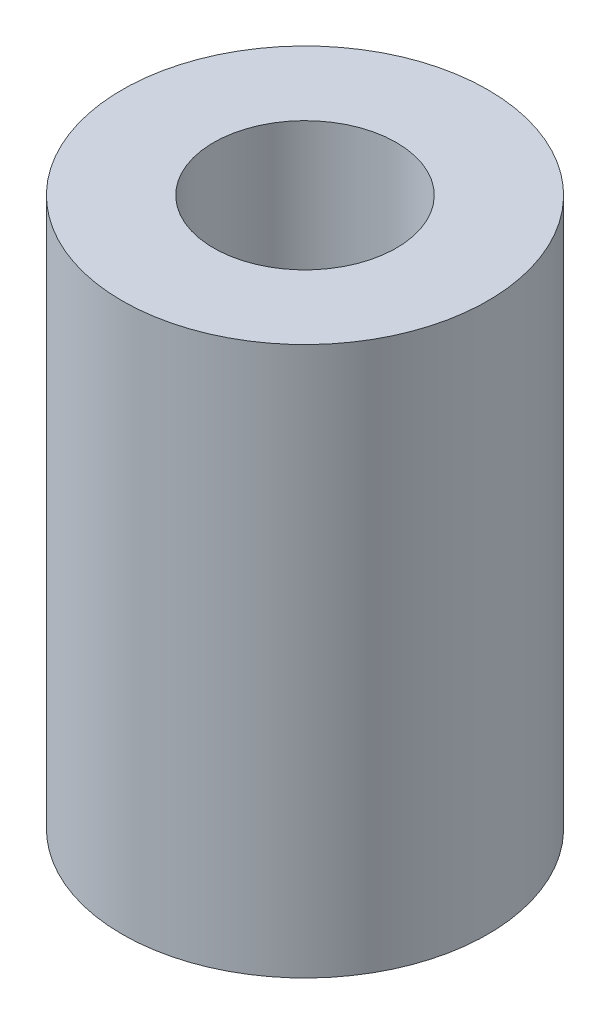
from build123d import *

# Parameters (mm, degrees)
SKETCH1_R           = 3.175
SKETCH1_R_2         = 1.5875
BOSS_EXTRUDE1_DEPTH = 9.525


with BuildPart() as part:
    # Sketch1 → Boss-Extrude1 (new body)
    with BuildSketch(Plane(origin=(0, 0, 0), x_dir=(1, 0, 0), z_dir=(0, 1, 0))):
        with Locations(Location((0, 0, 0), (0, 0, 90))):
            Circle(SKETCH1_R)
        with Locations(Location((0, 0, 0), (0, 0, 90))):
            Circle(SKETCH1_R_2, mode=Mode.SUBTRACT)
    extrude(amount=BOSS_EXTRUDE1_DEPTH)


solid = part.part
